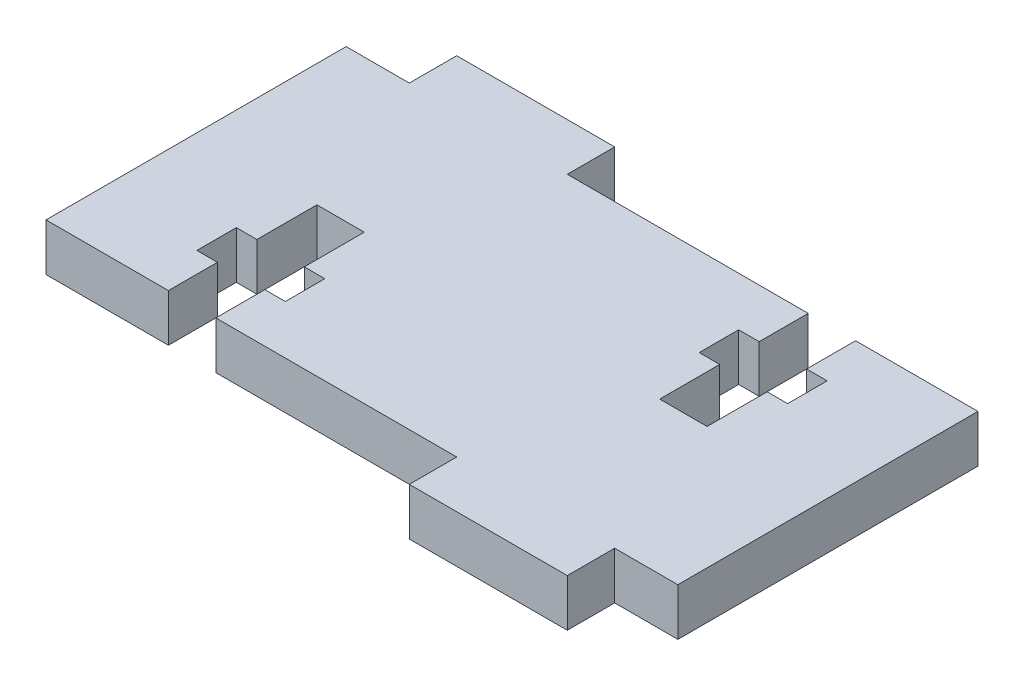
from build123d import *

# Parameters (mm, degrees)
BOSS_EXTRUDE2_DEPTH = 3


with BuildPart() as part:
    # Sketch2 → Boss-Extrude2 (new body)
    with BuildSketch(Plane(origin=(0, 0, 0), x_dir=(1, 0, 0), z_dir=(0, 1, 0))):
        Polygon((0, 0), (-4, 0), (-4, -3), (-14, -3), (-14, 0), (-29.25, 0), (-29.25, 3.1), (-27.95, 3.1), (-27.95, 5.6), (-29.25, 5.6), (-29.25, 9.4), (-32.25, 9.4), (-32.25, 5.6), (-33.55, 5.6), (-33.55, 3.1), (-32.25, 3.1), (-32.25, 0), (-40, 0), (-40, 19), (-36, 19), (-36, 22), (-26, 22), (-26, 19), (-10.75, 19), (-10.75, 15.9), (-12.05, 15.9), (-12.05, 13.4), (-10.75, 13.4), (-10.75, 9.6), (-7.75, 9.6), (-7.75, 13.4), (-6.45, 13.4), (-6.45, 15.9), (-7.75, 15.9), (-7.75, 19), (0, 19), align=None)
    extrude(amount=BOSS_EXTRUDE2_DEPTH)


solid = part.part
